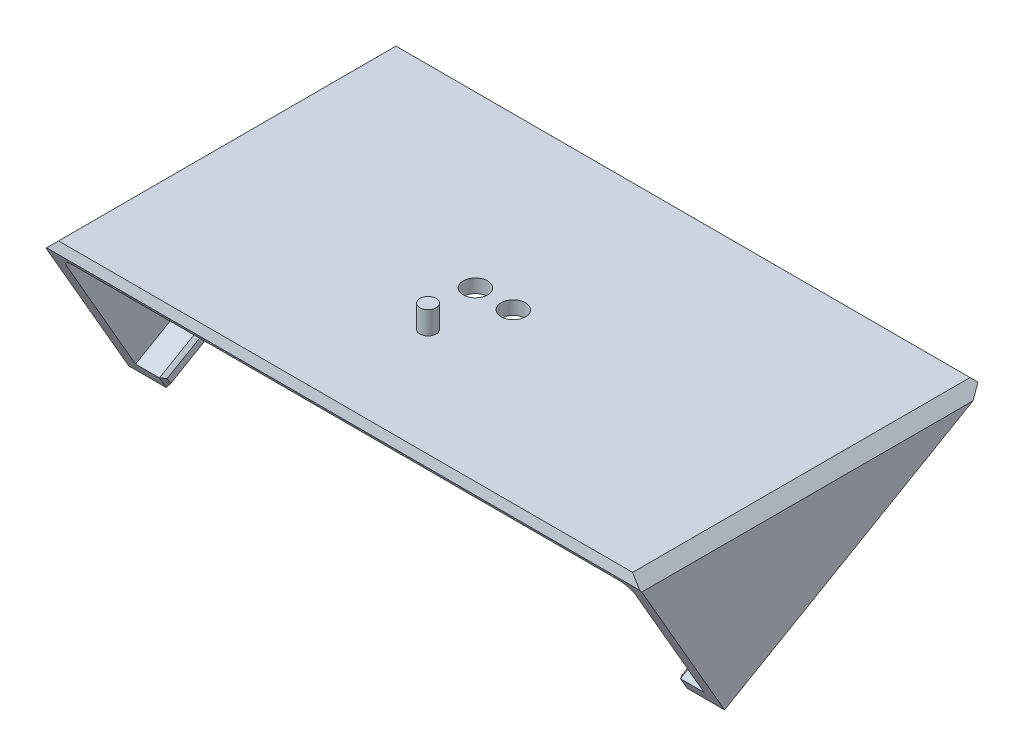
from build123d import *
from OCP.BRepFilletAPI import BRepFilletAPI_MakeChamfer

# Parameters (mm, degrees)
SKETCH2_W                = 139.7
SKETCH2_H                = 76.2
SKETCH2_R                = 2.8575
SKETCH2_R_2              = 1.905
BOSS_EXTRUDE1_DEPTH      = 3.175
BOSS_EXTRUDE2_DEPTH      = 3.175
BOSS_EXTRUDE3_DEPTH      = 136.525
SKETCH5_R                = 3.175
SKETCH5_R_2              = 0.635
BOSS_EXTRUDE4_DEPTH      = 6.604
FILLET1_R                = 2.54
CHAMFER1_SIZE            = 2.54
CHAMFER1_SIZE2           = 1.859409051
BOSS_EXTRUDE5_DEPTH      = 6.35
CHAMFER2_SIZE            = 0.762
CHAMFER2_OF_MIRROR2_SIZE = 0.762
SKETCH7_R                = 1.905
BOSS_EXTRUDE6_DEPTH      = 5.334


with BuildPart() as part:
    # Sketch2 → Boss-Extrude1 (new body)
    with BuildSketch(Plane(origin=(0, 0, 0), x_dir=(1, 0, 0), z_dir=(0, 1, 0))):
        with Locations((8.89, -1.27)):
            Rectangle(SKETCH2_W, SKETCH2_H)
        with Locations(Location((0, 0, 0), (0, 0, 270))):
            Circle(SKETCH2_R, mode=Mode.SUBTRACT)
        with Locations(Location((8.89, 0, 0), (0, 0, 270))):
            Circle(SKETCH2_R, mode=Mode.SUBTRACT)
        with Locations(Location((2.8575, -13.97, 0), (0, 0, 270))):
            Circle(SKETCH2_R_2, mode=Mode.SUBTRACT)
    extrude(amount=BOSS_EXTRUDE1_DEPTH)

    # Sketch3 → Boss-Extrude2 (add)
    with BuildSketch(Plane(origin=(78.74, 0, 0), x_dir=(0, 0, -1), z_dir=(1, 0, 0))):
        Polygon((-20.32, -32.995567884), (-39.37, 0), (36.83, 0), align=None)
        Polygon((-39.37, 3.175), (-41.203087105, 3.175), (-39.37, 0), align=None)
        Polygon((36.83, 0), (42.329261314, 3.175), (36.83, 3.175), align=None)
    boss_extrude2 = extrude(amount=-BOSS_EXTRUDE2_DEPTH)

    # Mirror1: Boss-Extrude2 across plane
    add(boss_extrude2.mirror(Plane(origin=(8.89, 0, 0), x_dir=(0, 0, 1), z_dir=(1, 0, 0))))

    # Sketch4 → Boss-Extrude3 (add)
    with BuildSketch(Plane(origin=(-57.785, 0, 0), x_dir=(0, 0, -1), z_dir=(1, 0, 0))):
        Polygon((-39.37, 3.175), (-41.203087105, 3.175), (-39.37, 0), align=None)
        Polygon((42.329261314, 3.175), (36.83, 3.175), (36.83, 0), align=None)
    extrude(amount=BOSS_EXTRUDE3_DEPTH)

    # Sketch5 → Boss-Extrude4 (add)
    # profile 1 of 3: a face of its own
    with BuildSketch(Plane.XZ):
        with Locations(Location((1.27, 26.3525, 0), (0, 0, 90))):
            Circle(SKETCH5_R)
        with Locations(Location((1.27, 26.3525, 0), (0, 0, 270))):
            Circle(SKETCH5_R_2, mode=Mode.SUBTRACT)
    # profile 2 of 3: a face of its own
    with BuildSketch(Plane.XZ):
        with Locations(Location((47.3075, 23.749, 0), (0, 0, 90))):
            Circle(SKETCH5_R)
        with Locations(Location((47.3075, 23.749, 0), (0, 0, 270))):
            Circle(SKETCH5_R_2, mode=Mode.SUBTRACT)
    # profile 3 of 3: a face of its own
    with BuildSketch(Plane.XZ):
        with Locations(Location((44.5135, -14.224, 0), (0, 0, 90))):
            Circle(SKETCH5_R)
        with Locations(Location((44.5135, -14.224, 0), (0, 0, 270))):
            Circle(SKETCH5_R_2, mode=Mode.SUBTRACT)
    extrude(amount=BOSS_EXTRUDE4_DEPTH)

    # Fillet1
    fillet1_edges = [part.edges().sort_by_distance(p)[0] for p in [
        (44.5135, 0, -17.399),
        (47.3075, 0, 20.574),
        (1.27, 0, 23.1775),
        (75.565, 0, 1.27),
        (-57.785, 0, 1.27),
    ]]
    fillet(fillet1_edges, radius=FILLET1_R)

    # Chamfer1: one chamfer whose edges measure the first distance from different faces: ONE call of the kernel's chamfer builder (chamfer() names one face for all edges)
    chamfer1_edges_1 = [part.edges().sort_by_distance(p)[0] for p in [
        (78.74, 3.175, -0.563087105),
        (-60.96, 3.175, -0.563087105),
    ]]
    chamfer1_edges_2 = [part.edges().sort_by_distance(p)[0] for p in [
        (8.89, 3.175, 41.203087105),
    ]]
    chamfer1_side_2 = [part.faces().sort_by_distance(p)[0] for p in [
        (8.89, 1.262750073, 40.099049095),
    ]]
    chamfer1_edges_3 = [part.edges().sort_by_distance(p)[0] for p in [
        (8.89, 3.175, -42.329261314),
    ]]
    chamfer1_side_3 = [part.faces().sort_by_distance(p)[0] for p in [
        (-59.332310127, 3.175, -0.563087105),
    ]]
    chamfer1 = BRepFilletAPI_MakeChamfer(part.part.solid().wrapped)
    for e in chamfer1_edges_1:
        chamfer1.Add(CHAMFER1_SIZE, e.wrapped)
    for e in chamfer1_edges_2:
        chamfer1.Add(CHAMFER1_SIZE, CHAMFER1_SIZE2, e.wrapped, chamfer1_side_2[0].wrapped)  # the first distance lies on this face
    for e in chamfer1_edges_3:
        chamfer1.Add(CHAMFER1_SIZE, CHAMFER1_SIZE2, e.wrapped, chamfer1_side_3[0].wrapped)  # the first distance lies on this face
    add(Compound.cast(chamfer1.Shape()), mode=Mode.REPLACE)

    # Sketch6 → Boss-Extrude5 (add)
    with BuildSketch(Plane(origin=(-57.785, 0, 0), x_dir=(0, 0, -1), z_dir=(1, 0, 0))):
        Polygon((-20.32, -32.995567884), (12.675567884, -13.945567884), (11.088067884, -11.195937227), (-21.9075, -30.245937227), align=None)
    boss_extrude5 = extrude(amount=BOSS_EXTRUDE5_DEPTH)

    # Chamfer2
    chamfer2_edges = [part.edges().sort_by_distance(p)[0] for p in [
        (-51.435, -31.620752556, 21.11375),
        (-51.435, -23.470567884, 3.822216058),
        (-51.435, -12.570752556, -11.881817884),
        (-51.435, -20.720937227, 5.409716058),
    ]]
    chamfer(chamfer2_edges, length=CHAMFER2_SIZE)

    # Mirror2: Boss-Extrude5 across plane
    add(boss_extrude5.mirror(Plane(origin=(8.89, 0, 0), x_dir=(0, 0, 1), z_dir=(1, 0, 0))))

    # Chamfer2 of Mirror2
    chamfer2_of_mirror2_edges = [part.edges().sort_by_distance(p)[0] for p in [
        (69.215, -31.620752556, 21.11375),
        (69.215, -23.470567884, 3.822216058),
        (69.215, -12.570752556, -11.881817884),
        (69.215, -20.720937227, 5.409716058),
    ]]
    chamfer(chamfer2_of_mirror2_edges, length=CHAMFER2_OF_MIRROR2_SIZE)


with BuildPart() as body_2:
    # Sketch7 → Boss-Extrude6 (new body)
    with BuildSketch(Plane(origin=(0, 3.175, 0), x_dir=(1, 0, 0), z_dir=(0, 1, 0))):
        with Locations(Location((2.8575, -13.97, 0), (0, 0, 270))):
            Circle(SKETCH7_R)
    extrude(amount=BOSS_EXTRUDE6_DEPTH)


solid = Compound([part.part, body_2.part])
